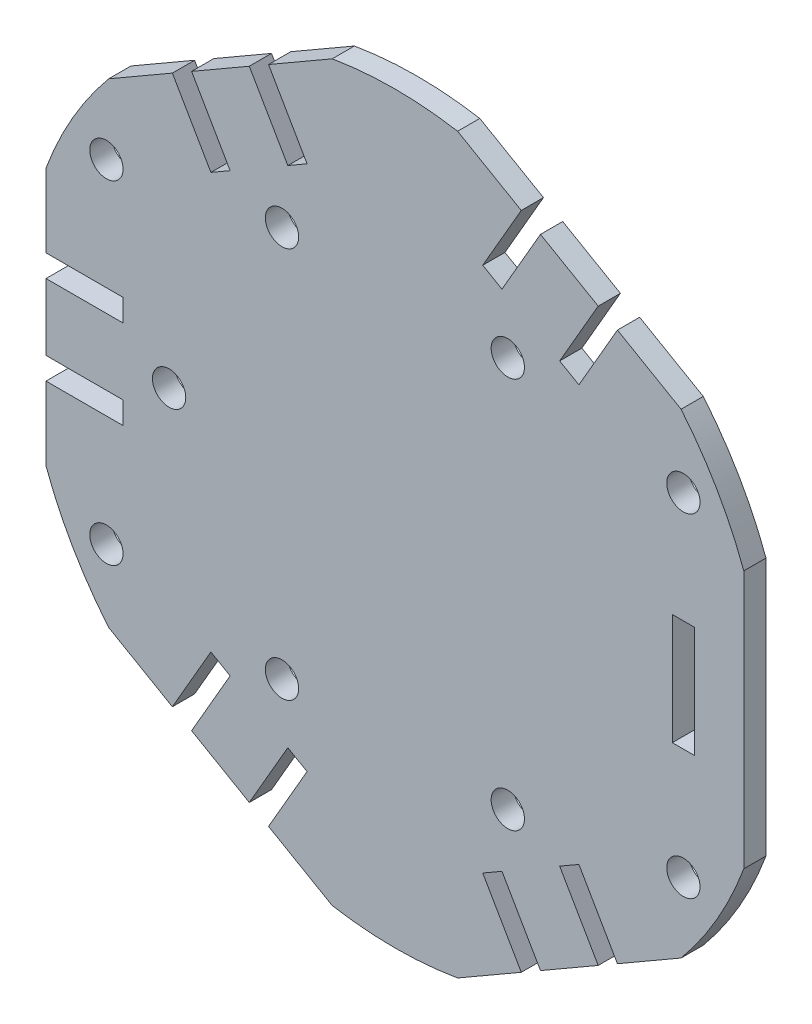
from build123d import *

# Parameters (mm, degrees)
MODEL_R             = 1.5
MODEL_W             = 2
MODEL_H             = 10
BOSS_EXTRUDE2_DEPTH = 2


with BuildPart() as part:
    # Model → Boss-Extrude2 (new body)
    with BuildSketch(Plane.XY):
        with BuildLine():
            Line((2079.513177421, 1320.324687976), (2079.513177421, 1322.324687976))
            Line((2079.513177421, 1322.324687976), (2072.573837593, 1322.324687976))
            Line((2072.573837593, 1322.324687976), (2072.573837593, 1328.324687976))
            Line((2072.573837593, 1328.324687976), (2079.513177421, 1328.324687976))
            Line((2079.513177421, 1328.324687976), (2079.513177421, 1330.324687976))
            Line((2079.513177421, 1330.324687976), (2072.573837593, 1330.324687976))
            Line((2072.573837593, 1330.324687976), (2072.573837593, 1336.943408379))
            ThreePointArc((2072.573837593, 1336.943408379), (2074.982606168, 1342.074687976), (2078.222040366, 1346.726382553))
            Line((2078.222040366, 1346.726382553), (2083.954020375, 1350.035742754))
            Line((2083.954020375, 1350.035742754), (2087.423690289, 1344.026098178))
            Line((2087.423690289, 1344.026098178), (2089.155741097, 1345.026098178))
            Line((2089.155741097, 1345.026098178), (2085.686071183, 1351.035742754))
            Line((2085.686071183, 1351.035742754), (2090.882223605, 1354.035742754))
            Line((2090.882223605, 1354.035742754), (2094.351893519, 1348.026098178))
            Line((2094.351893519, 1348.026098178), (2096.083944327, 1349.026098178))
            Line((2096.083944327, 1349.026098178), (2092.614274413, 1355.035742754))
            Line((2092.614274413, 1355.035742754), (2098.346254422, 1358.345102956))
            ThreePointArc((2098.346254422, 1358.345102956), (2103.994457195, 1358.824687976), (2109.642659968, 1358.345102956))
            Line((2109.642659968, 1358.345102956), (2115.374639977, 1355.035742754))
            Line((2115.374639977, 1355.035742754), (2111.904970063, 1349.026098178))
            Line((2111.904970063, 1349.026098178), (2113.637020871, 1348.026098178))
            Line((2113.637020871, 1348.026098178), (2117.106690785, 1354.035742754))
            Line((2117.106690785, 1354.035742754), (2122.302843208, 1351.035742754))
            Line((2122.302843208, 1351.035742754), (2118.833173294, 1345.026098178))
            Line((2118.833173294, 1345.026098178), (2120.565224101, 1344.026098178))
            Line((2120.565224101, 1344.026098178), (2124.034894015, 1350.035742754))
            Line((2124.034894015, 1350.035742754), (2129.766874025, 1346.726382553))
            ThreePointArc((2129.766874025, 1346.726382553), (2133.006308222, 1342.074687976), (2135.415076798, 1336.943408379))
            Line((2135.415076798, 1336.943408379), (2135.415076798, 1313.705967573))
            ThreePointArc((2135.415076798, 1313.705967573), (2133.006308222, 1308.574687976), (2129.766874025, 1303.922993399))
            Line((2129.766874025, 1303.922993399), (2124.034894015, 1300.613633198))
            Line((2124.034894015, 1300.613633198), (2120.565224101, 1306.623277774))
            Line((2120.565224101, 1306.623277774), (2118.833173294, 1305.623277774))
            Line((2118.833173294, 1305.623277774), (2122.302843208, 1299.613633198))
            Line((2122.302843208, 1299.613633198), (2117.106690785, 1296.613633198))
            Line((2117.106690785, 1296.613633198), (2113.637020871, 1302.623277774))
            Line((2113.637020871, 1302.623277774), (2111.904970063, 1301.623277774))
            Line((2111.904970063, 1301.623277774), (2115.374639977, 1295.613633198))
            Line((2115.374639977, 1295.613633198), (2109.642659968, 1292.304272996))
            ThreePointArc((2109.642659968, 1292.304272996), (2103.994457195, 1291.824687976), (2098.346254422, 1292.304272996))
            Line((2098.346254422, 1292.304272996), (2092.614274413, 1295.613633198))
            Line((2092.614274413, 1295.613633198), (2096.083944327, 1301.623277774))
            Line((2096.083944327, 1301.623277774), (2094.351893519, 1302.623277774))
            Line((2094.351893519, 1302.623277774), (2090.882223605, 1296.613633198))
            Line((2090.882223605, 1296.613633198), (2085.686071183, 1299.613633198))
            Line((2085.686071183, 1299.613633198), (2089.155741097, 1305.623277774))
            Line((2089.155741097, 1305.623277774), (2087.423690289, 1306.623277774))
            Line((2087.423690289, 1306.623277774), (2083.954020375, 1300.613633198))
            Line((2083.954020375, 1300.613633198), (2078.222040366, 1303.922993399))
            ThreePointArc((2078.222040366, 1303.922993399), (2074.982606168, 1308.574687976), (2072.573837593, 1313.705967573))
            Line((2072.573837593, 1313.705967573), (2072.573837593, 1320.324687976))
            Line((2072.573837593, 1320.324687976), (2079.513177421, 1320.324687976))
        make_face()
        with Locations((2083.65962403, 1325.324687976)):
            Circle(MODEL_R, mode=Mode.SUBTRACT)
        with Locations((2093.827040613, 1342.935170078)):
            Circle(MODEL_R, mode=Mode.SUBTRACT)
        with Locations((2093.827040613, 1307.714205874)):
            Circle(MODEL_R, mode=Mode.SUBTRACT)
        with Locations((2114.161873777, 1307.714205874)):
            Circle(MODEL_R, mode=Mode.SUBTRACT)
        with Locations((2114.161873777, 1342.935170078)):
            Circle(MODEL_R, mode=Mode.SUBTRACT)
        with Locations((2078.013695082, 1340.324687976)):
            Circle(MODEL_R, mode=Mode.SUBTRACT)
        with Locations((2078.013695082, 1310.324687976)):
            Circle(MODEL_R, mode=Mode.SUBTRACT)
        with Locations((2129.975219309, 1340.324687976)):
            Circle(MODEL_R, mode=Mode.SUBTRACT)
        with Locations((2129.975219309, 1310.324687976)):
            Circle(MODEL_R, mode=Mode.SUBTRACT)
        with Locations((2129.976886457, 1325.324687976)):
            Rectangle(MODEL_W, MODEL_H, mode=Mode.SUBTRACT)
    extrude(amount=BOSS_EXTRUDE2_DEPTH)


solid = part.part
